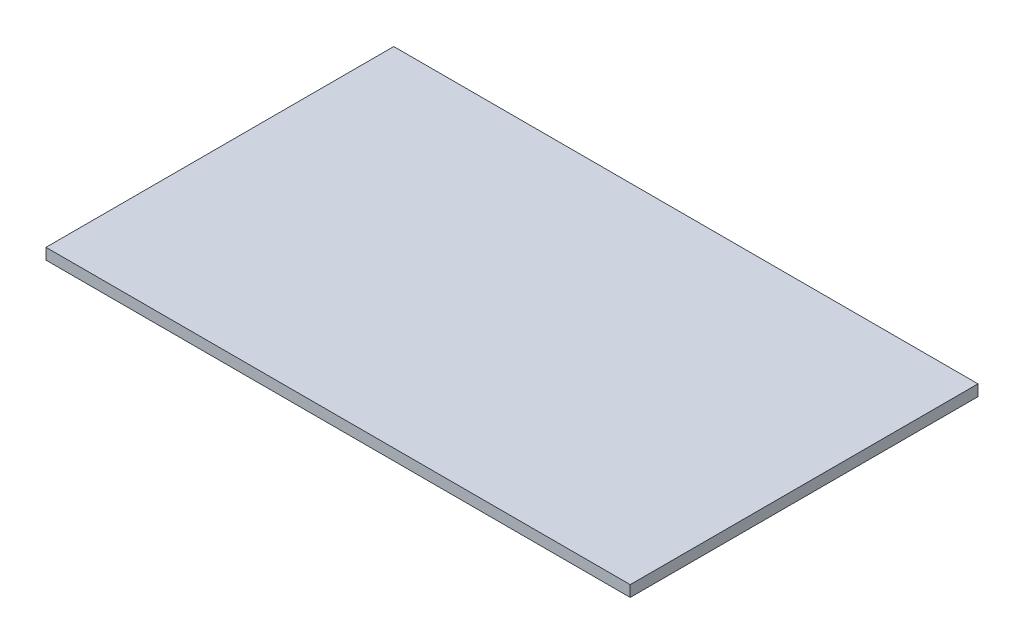
from build123d import *

# Parameters (mm, degrees)
SKETCH1_W           = 420
SKETCH1_H           = 250
BOSS_EXTRUDE1_DEPTH = 8


with BuildPart() as part:
    # Sketch1 → Boss-Extrude1 (new body)
    with BuildSketch(Plane(origin=(0, 0, 0), x_dir=(1, 0, 0), z_dir=(0, 1, 0))):
        with Locations((210, -125)):
            Rectangle(SKETCH1_W, SKETCH1_H)
    extrude(amount=BOSS_EXTRUDE1_DEPTH)


solid = part.part
